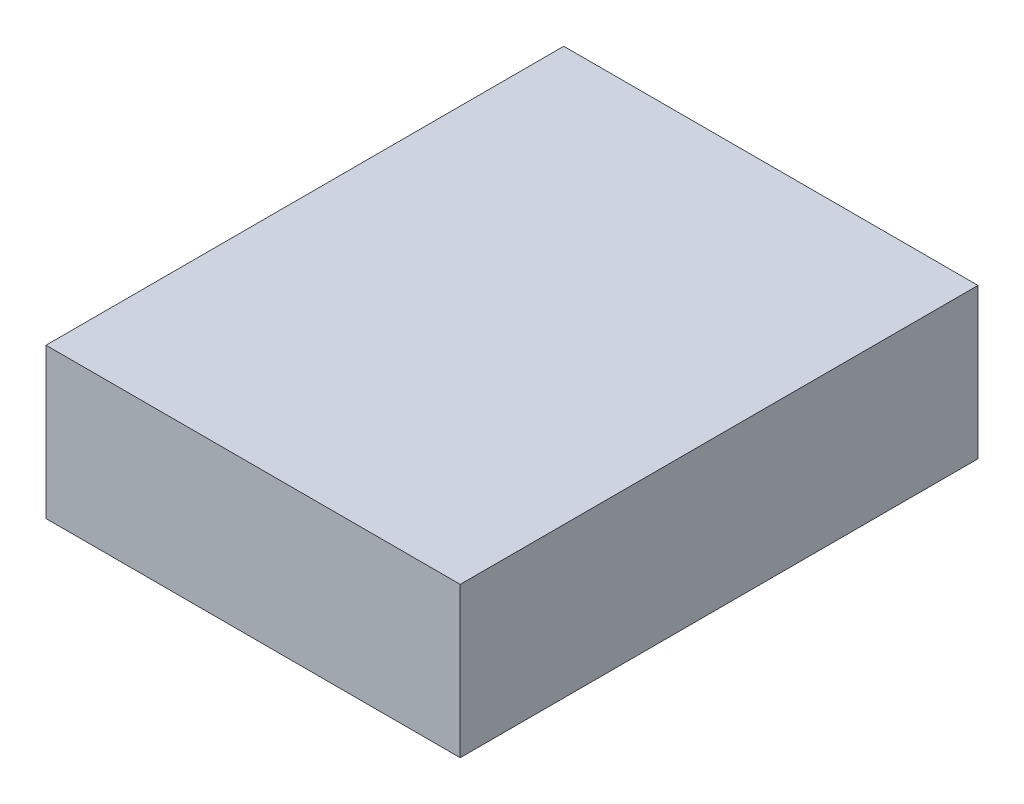
from build123d import *

# Parameters (mm, degrees)
SKETCH1_W           = 80
SKETCH1_H           = 100
BOSS_EXTRUDE1_DEPTH = 29


with BuildPart() as part:
    # Sketch1 → Boss-Extrude1 (new body)
    with BuildSketch(Plane(origin=(0, 0, 0), x_dir=(1, 0, 0), z_dir=(0, 1, 0))):
        Rectangle(SKETCH1_W, SKETCH1_H)
    extrude(amount=BOSS_EXTRUDE1_DEPTH)


solid = part.part
